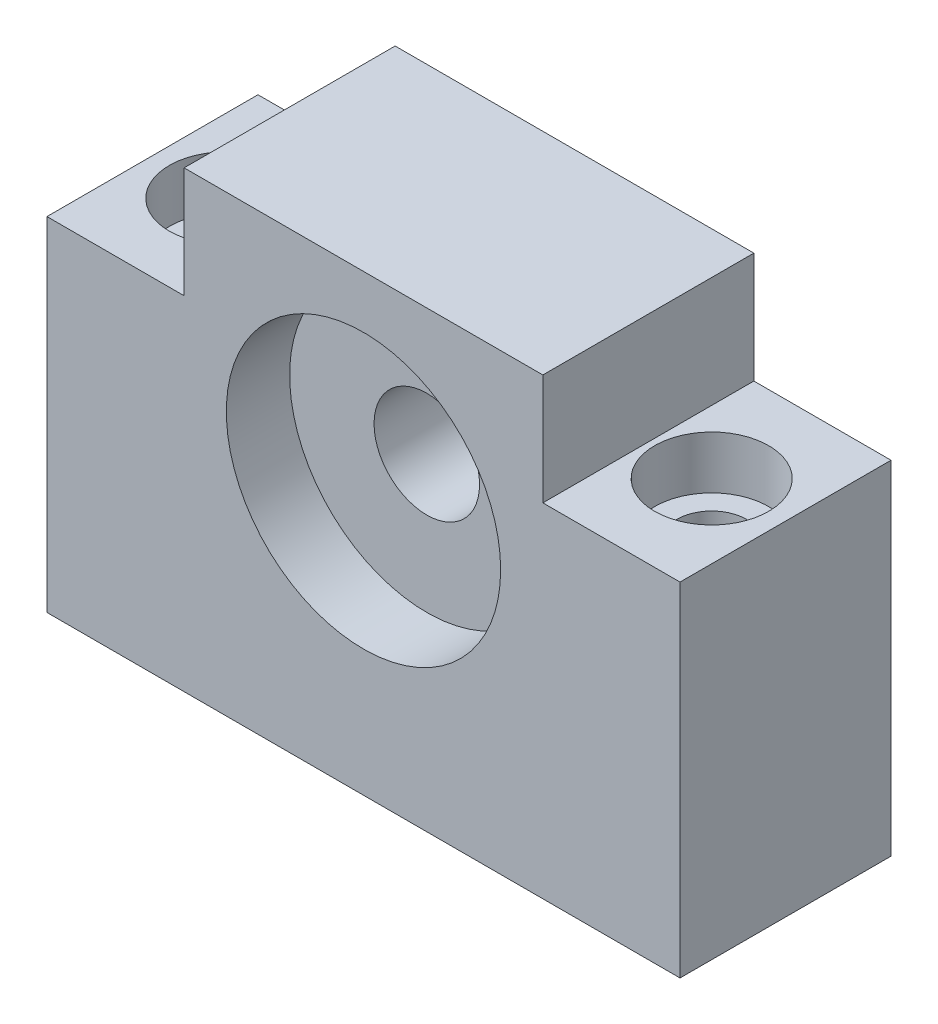
from build123d import *

# Parameters (mm, degrees)
ESQUISSE1_R             = 5
BOSS_EXTRU_1_DEPTH      = 20
ENL_V_MAT_EXTRU_1_REACH = 51.891
ESQUISSE2_R             = 3.3
ESQUISSE3_R             = 5.4
ENL_V_MAT_EXTRU_2_DEPTH = 5
ESQUISSE4_R             = 13
ENL_V_MAT_EXTRU_3_DEPTH = 6
ENL_V_START             = -6
ESQUISSE5_R             = 13
ENL_V_MAT_EXTRU_4_DEPTH = 6


with BuildPart() as part:
    # Esquisse1 → Boss.-Extru.1 (new body)
    with BuildSketch(Plane.XY):
        Polygon((-27.861974124, -13.935926773), (32.138025876, -13.935926773), (32.138025876, 18.564073227), (19.138025876, 18.564073227), (19.138025876, 29.064073227), (-14.861974124, 29.064073227), (-14.861974124, 18.564073227), (-27.861974124, 18.564073227), align=None)
        with Locations((2.138025876, 11.064073227)):
            Circle(ESQUISSE1_R, mode=Mode.SUBTRACT)
    extrude(amount=BOSS_EXTRU_1_DEPTH)

    # Esquisse2 → Enlèv. mat.-Extru.1 (cut, up to next)
    with BuildSketch(Plane(origin=(0, 18.564073227, 0), x_dir=(1, 0, 0), z_dir=(0, 1, 0)), mode=Mode.PRIVATE) as enl_v_mat_extru_1_sk1:
        with Locations(Location((25.138025876, -10, 0), (0, 0, 270))):
            Circle(ESQUISSE2_R)
    enl_v_mat_extru_1_tool1 = extrude(enl_v_mat_extru_1_sk1.sketch, amount=-ENL_V_MAT_EXTRU_1_REACH, mode=Mode.PRIVATE) & part.part
    # Esquisse2 → Enlèv. mat.-Extru.1 (cut, up to next)
    with BuildSketch(Plane(origin=(0, 18.564073227, 0), x_dir=(1, 0, 0), z_dir=(0, 1, 0)), mode=Mode.PRIVATE) as enl_v_mat_extru_1_sk2:
        with Locations(Location((-20.861974124, -10, 0), (0, 0, 270))):
            Circle(ESQUISSE2_R)
    enl_v_mat_extru_1_tool2 = extrude(enl_v_mat_extru_1_sk2.sketch, amount=-ENL_V_MAT_EXTRU_1_REACH, mode=Mode.PRIVATE) & part.part
    add(enl_v_mat_extru_1_tool1.solids().sort_by_distance((25.138026, 18.564073, 10))[0], mode=Mode.SUBTRACT)
    add(enl_v_mat_extru_1_tool2.solids().sort_by_distance((-20.861974, 18.564073, 10))[0], mode=Mode.SUBTRACT)

    # Esquisse3 → Enlèv. mat.-Extru.2 (cut)
    with BuildSketch(Plane(origin=(0, 18.564073227, 0), x_dir=(1, 0, 0), z_dir=(0, 1, 0))):
        with Locations(Location((25.138025876, -10, 0), (0, 0, 270))):
            Circle(ESQUISSE3_R)
        with Locations(Location((-20.861974124, -10, 0), (0, 0, 270))):
            Circle(ESQUISSE3_R)
    extrude(amount=-ENL_V_MAT_EXTRU_2_DEPTH, mode=Mode.SUBTRACT)

    # Esquisse4 → Enlèv. mat.-Extru.3 (cut)
    with BuildSketch(Plane.XY.offset(20)):
        with Locations((2.138025876, 11.064073227)):
            Circle(ESQUISSE4_R)
    extrude(amount=-ENL_V_MAT_EXTRU_3_DEPTH, mode=Mode.SUBTRACT)

    # Esquisse5 → Enlèv. mat.-Extru.4 (cut)
    with BuildSketch(Plane(origin=(0, 0, 0), x_dir=(-1, 0, 0), z_dir=(0, 0, -1)).offset(ENL_V_START)):
        with Locations(Location((-2.138025876, 11.064073227, 0), (0, 0, 180))):
            Circle(ESQUISSE5_R)
    extrude(amount=ENL_V_MAT_EXTRU_4_DEPTH, mode=Mode.SUBTRACT)


solid = part.part
